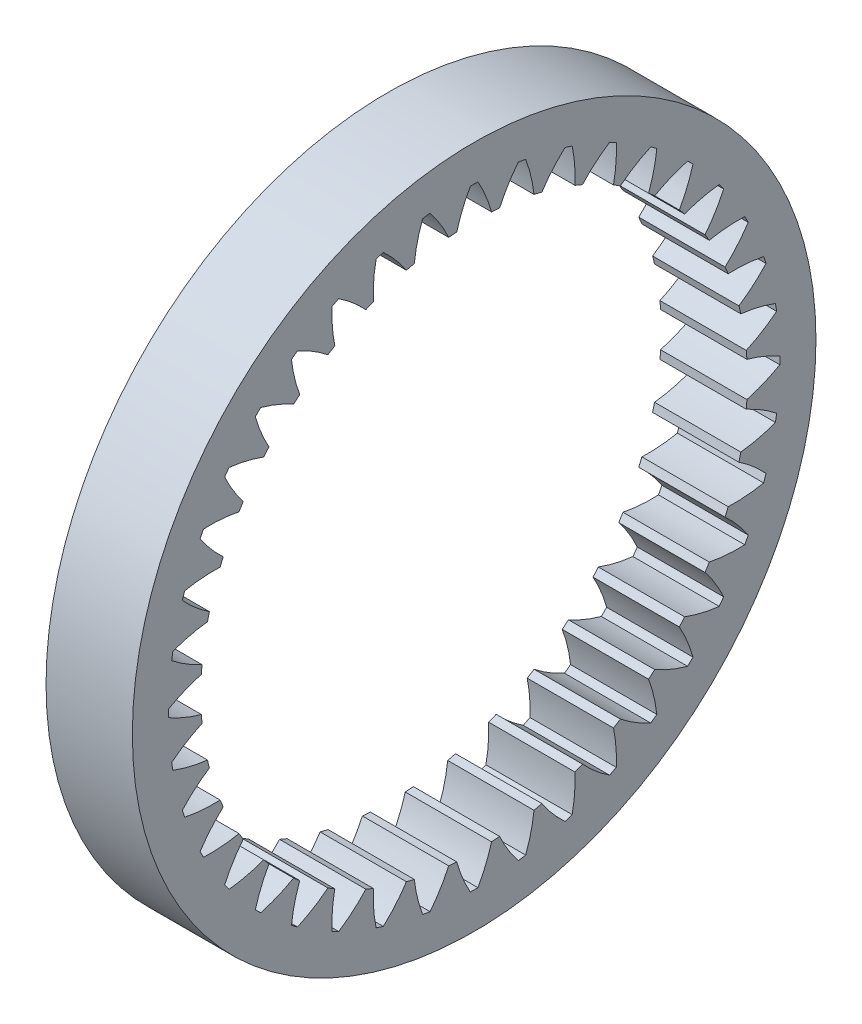
from build123d import *

# Parameters (mm, degrees)
BASPROSKE_W         = 12
BASPROSKE_H         = 4.5264
TOOTHCUT_DEPTH      = 62.326905954
TEETHCUTS_COUNT     = 40
TEETHCUTS_ANGLE     = 351
SKETCH1_R           = 47.5264
SKETCH1_R_2         = 42.5264
BOSS_EXTRUDE1_DEPTH = 12


with BuildPart() as part:
    # BasProSke → Base-Revolve (revolve)
    with BuildSketch(Plane(origin=(0, 0, 0), x_dir=(1, 0, 0), z_dir=(0, 1, 0)), mode=Mode.PRIVATE) as base_revolve_sk:
        with Locations((6, 40.2632)):
            Rectangle(BASPROSKE_W, BASPROSKE_H)
    revolve(base_revolve_sk.sketch.rotate(Axis((-10, 0, 0), (1, 0, 0)), 180), axis=Axis((-10, 0, 0), (1, 0, 0)))

    # TooCutSke → ToothCut (cut, through all)
    with BuildSketch(Plane(origin=(0, 0, 0), x_dir=(0, 0, -1), z_dir=(1, 0, 0))):
        with BuildLine():
            ThreePointArc((2.427265626, 37.896947459), (1.618641911, 40.256878641), (0.522524415, 42.497787816))
            ThreePointArc((0.522524415, 42.497787816), (0, 42.501), (-0.522524415, 42.497787816))
            ThreePointArc((-0.522524415, 42.497787816), (-1.618641911, 40.256878641), (-2.427265626, 37.896947459))
            ThreePointArc((-2.427265626, 37.896947459), (0, 37.9746), (2.427265626, 37.896947459))
        make_face()
    toothcut = extrude(amount=TOOTHCUT_DEPTH, mode=Mode.SUBTRACT)

    # TeethCuts: ToothCut ×40 about axis
    teethcuts_axis = Axis((-10, 0, 0), (1, 0, 0))
    for i in range(1, TEETHCUTS_COUNT):
        add(toothcut.rotate(teethcuts_axis, i * TEETHCUTS_ANGLE / (TEETHCUTS_COUNT - 1)), mode=Mode.SUBTRACT)

    # Sketch1 → Boss-Extrude1 (add, through all)
    with BuildSketch(Plane(origin=(12, 0, 0), x_dir=(0, 0, -1), z_dir=(1, 0, 0))):
        Circle(SKETCH1_R)
        Circle(SKETCH1_R_2, mode=Mode.SUBTRACT)
    extrude(amount=-BOSS_EXTRUDE1_DEPTH)


solid = part.part
